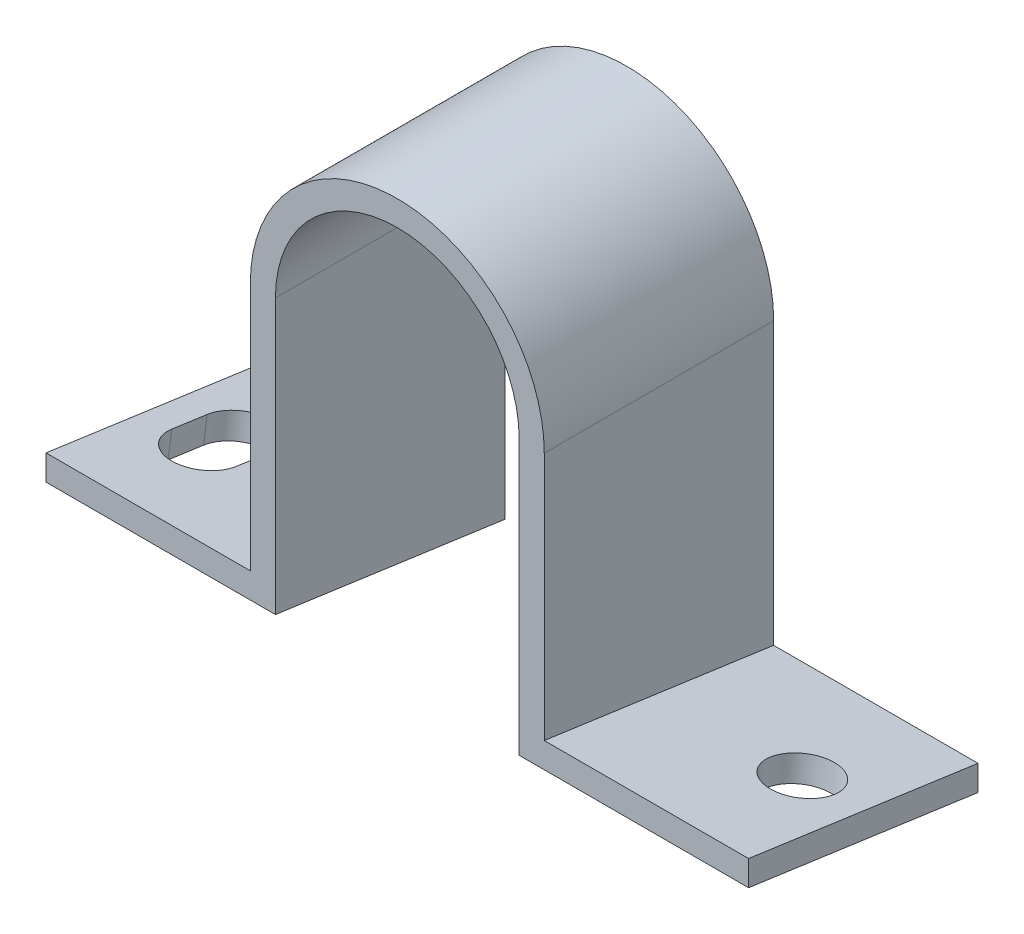
from build123d import *

# Parameters (mm, degrees)
EXTRUDE_1_DEPTH     = 16
CUT_EXTRUDE_1_DEPTH = 50
EXTRUDE_2_DEPTH     = 28.5
SKETCH_4_R          = 4.5
CUT_EXTRUDE_2_DEPTH = 28.5


with BuildPart() as part:
    # 草图1 → 凸台-拉伸1 (new, symmetric)
    with BuildSketch(Plane.XY):
        with BuildLine():
            Line((-17, 0), (-17, -66.86388681))
            Line((-17, -66.86388681), (-20.5, -66.86388681))
            Line((-20.5, -66.86388681), (-20.5, 0))
            ThreePointArc((-20.5, 0), (0, 20.5), (20.5, 0))
            Line((20.5, 0), (20.5, -66.86388681))
            Line((20.5, -66.86388681), (17, -66.86388681))
            Line((17, -66.86388681), (17, 0))
            ThreePointArc((17, 0), (0, 17), (-17, 0))
        make_face()
    extrude(amount=EXTRUDE_1_DEPTH, both=True)

    # 草图2 → 切除-拉伸1 (cut, symmetric)
    with BuildSketch(Plane(origin=(0, 0, 0), x_dir=(0, 0, -1), z_dir=(1, 0, 0))):
        Polygon((16, -42.748653355), (-16, -38.251346645), (-16, -66.86388681), (16, -66.86388681), align=None)
    extrude(amount=CUT_EXTRUDE_1_DEPTH, both=True, mode=Mode.SUBTRACT)

    # 草图3 → 凸台-拉伸2 (add)
    with BuildSketch(Plane.ZY.offset(20.5)):
        Polygon((-16, -42.748653355), (16, -38.251346645), (16, -34.716950141), (-16, -39.214256851), align=None)
    extrude_2 = extrude(amount=EXTRUDE_2_DEPTH)

    # 镜向1: 凸台-拉伸2 across plane
    add(extrude_2.mirror(Plane(origin=(0, 0, 0), x_dir=(0, 0, 1), z_dir=(1, 0, 0))))

    # 草图4 → 切除-拉伸2 (cut)
    with BuildSketch(Plane(origin=(0, -36.249611102, 5.094550602), x_dir=(1, 0, 0), z_dir=(0, 0.9902680687415715, -0.13917310096005808))):
        with Locations(Location((40.5, 5.144617667, 0), (0, 0, 270))):
            Circle(SKETCH_4_R)
        with BuildLine():
            Line((-36, 7.644617667), (-36, 2.644617667))
            ThreePointArc((-36, 2.644617667), (-40.5, -1.855382333), (-45, 2.644617667))
            Line((-45, 2.644617667), (-45, 7.644617667))
            ThreePointArc((-45, 7.644617667), (-40.5, 12.144617667), (-36, 7.644617667))
        make_face()
    extrude(amount=-CUT_EXTRUDE_2_DEPTH, mode=Mode.SUBTRACT)


solid = part.part
